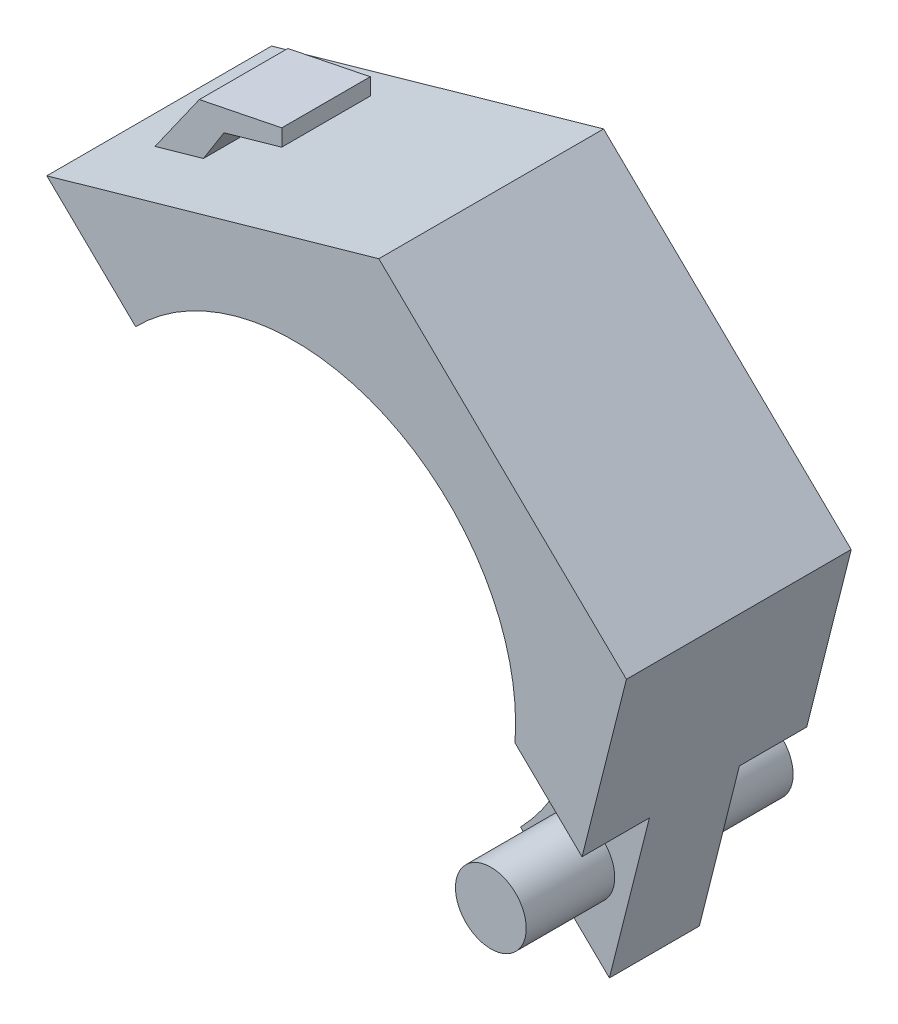
from build123d import *

# Parameters (mm, degrees)
BOSS_EXTRUDE1_DEPTH = 25.4
CUT_EXTRUDE1_DEPTH  = 7.62
SKETCH3_R           = 4
BOSS_EXTRUDE2_DEPTH = 10
BOSS_EXTRUDE3_DEPTH = 5


with BuildPart() as part:
    # Sketch1 → Boss-Extrude1 (new body)
    with BuildSketch(Plane.XY):
        with BuildLine():
            Line((9.541145468, 37.814898429), (-27.978089947, 27.17032357))
            Line((-27.978089947, 27.17032357), (-17.934673043, 17.416874084))
            ThreePointArc((-17.934673043, 17.416874084), (17.416874084, 17.934673043), (17.934673043, -17.416874084))
            Line((17.934673043, -17.416874084), (27.978089947, -27.17032357))
            Line((27.978089947, -27.17032357), (37.519235415, 10.644574858))
            Line((37.519235415, 10.644574858), (9.541145468, 37.814898429))
        make_face()
    extrude(amount=BOSS_EXTRUDE1_DEPTH)

    # Sketch2 → Cut-Extrude1 (cut)
    with BuildSketch(Plane.XY.offset(25.4)):
        Polygon((21.419411921, 1.52926165), (45.089583043, -21.457518704), (5.352657375, -38.695482799), align=None)
    cut_extrude1 = extrude(amount=-CUT_EXTRUDE1_DEPTH, mode=Mode.SUBTRACT)

    # Sketch3 → Boss-Extrude2 (add)
    with BuildSketch(Plane.XY.offset(17.78)):
        with Locations((24.578895169, -17.023104028)):
            Circle(SKETCH3_R)
    boss_extrude2 = extrude(amount=BOSS_EXTRUDE2_DEPTH)

    # Mirror1: Cut-Extrude1, Boss-Extrude2 across plane
    add(cut_extrude1.mirror(Plane(origin=(0, 0, 12.7), x_dir=(1, 0, 0), z_dir=(0, 0, -1))), mode=Mode.SUBTRACT)
    add(boss_extrude2.mirror(Plane(origin=(0, 0, 12.7), x_dir=(1, 0, 0), z_dir=(0, 0, -1))))

    # Sketch4 → Boss-Extrude3 (add, symmetric)
    with BuildSketch(Plane(origin=(0, 0, 12.7), x_dir=(-1, 0, 0), z_dir=(0, 0, -1))):
        Polygon((23.45113357, 28.454665469), (18.442827964, 35.547681457), (9.125788769, 37.439046087), (9.125788769, 35.547681457), (15.649252306, 33.696910907), (17.983802714, 30.005800825), align=None)
    extrude(amount=BOSS_EXTRUDE3_DEPTH, both=True)


solid = part.part
